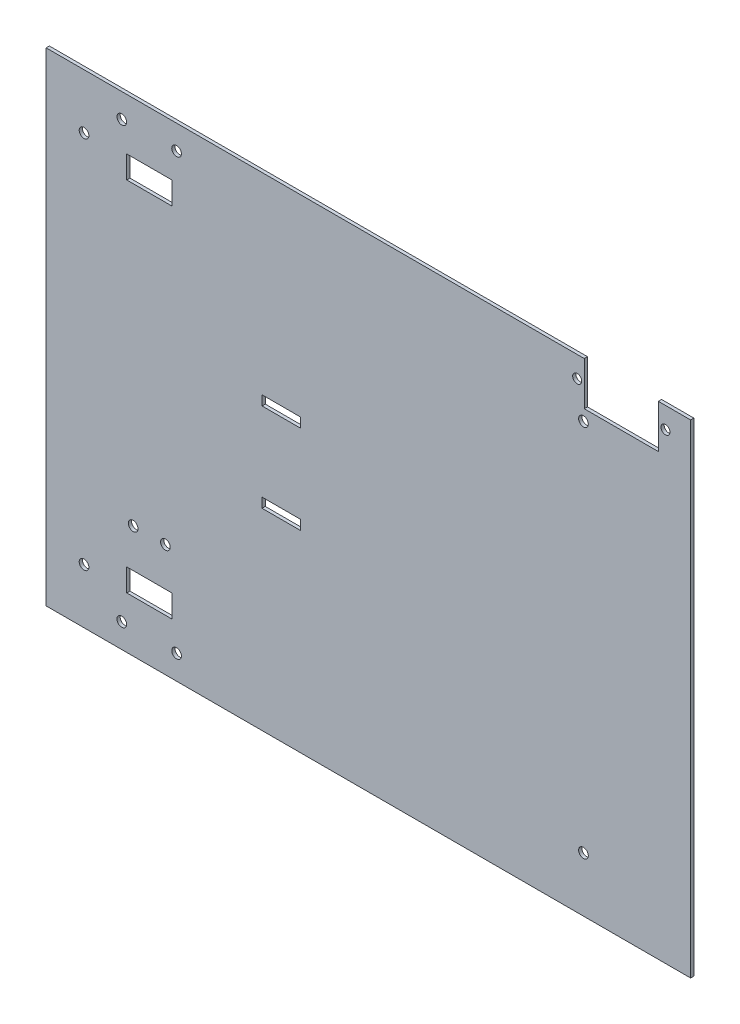
from build123d import *

# Parameters (mm, degrees)
SKETCH1_W           = 200
SKETCH1_H           = 150
BOSS_EXTRUDE1_DEPTH = 1
SKETCH2_R           = 1.5
SKETCH2_R_2         = 1.4
SKETCH2_W           = 14
SKETCH2_H           = 7
SKETCH2_W_2         = 12
SKETCH2_H_2         = 3
SKETCH2_W_3         = 23
SKETCH2_H_3         = 13.5
CUT_EXTRUDE1_DEPTH  = 1


with BuildPart() as part:
    # Sketch1 → Boss-Extrude1 (new body)
    with BuildSketch(Plane.XY):
        Rectangle(SKETCH1_W, SKETCH1_H)
    extrude(amount=BOSS_EXTRUDE1_DEPTH)

    # Sketch2 → Cut-Extrude1 (cut)
    with BuildSketch(Plane.XY.offset(1)):
        with Locations((-76.53, -67.5)):
            Circle(SKETCH2_R)
        with Locations((-59.53, -67.5)):
            Circle(SKETCH2_R)
        with Locations(Location((-59.53, 67.5, 0), (0, 0, 180))):
            Circle(SKETCH2_R)
        with Locations(Location((-76.53, 67.5, 0), (0, 0, 180))):
            Circle(SKETCH2_R)
        with Locations((-73, -40)):
            Circle(SKETCH2_R)
        with Locations((-63, -40)):
            Circle(SKETCH2_R)
        with Locations((-88.25346752, -58)):
            Circle(SKETCH2_R)
        with Locations((66.74653248, -58)):
            Circle(SKETCH2_R)
        with Locations(Location((66.74653248, 58, 0), (0, 0, 180))):
            Circle(SKETCH2_R)
        with Locations(Location((-88.25346752, 58, 0), (0, 0, 180))):
            Circle(SKETCH2_R)
        with Locations((64.8, 68.5)):
            Circle(SKETCH2_R_2)
        with Locations((92.2, 68.5)):
            Circle(SKETCH2_R_2)
        with Locations((-68, -55.5)):
            Rectangle(SKETCH2_W, SKETCH2_H)
        with Locations((-68, 55.5)):
            Rectangle(SKETCH2_W, SKETCH2_H)
        with Locations((-27, -13.75)):
            Rectangle(SKETCH2_W_2, SKETCH2_H_2)
        with Locations((-27, 13.75)):
            Rectangle(SKETCH2_W_2, SKETCH2_H_2)
        with Locations((78.5, 68.25)):
            Rectangle(SKETCH2_W_3, SKETCH2_H_3)
    extrude(amount=-CUT_EXTRUDE1_DEPTH, mode=Mode.SUBTRACT)


solid = part.part
